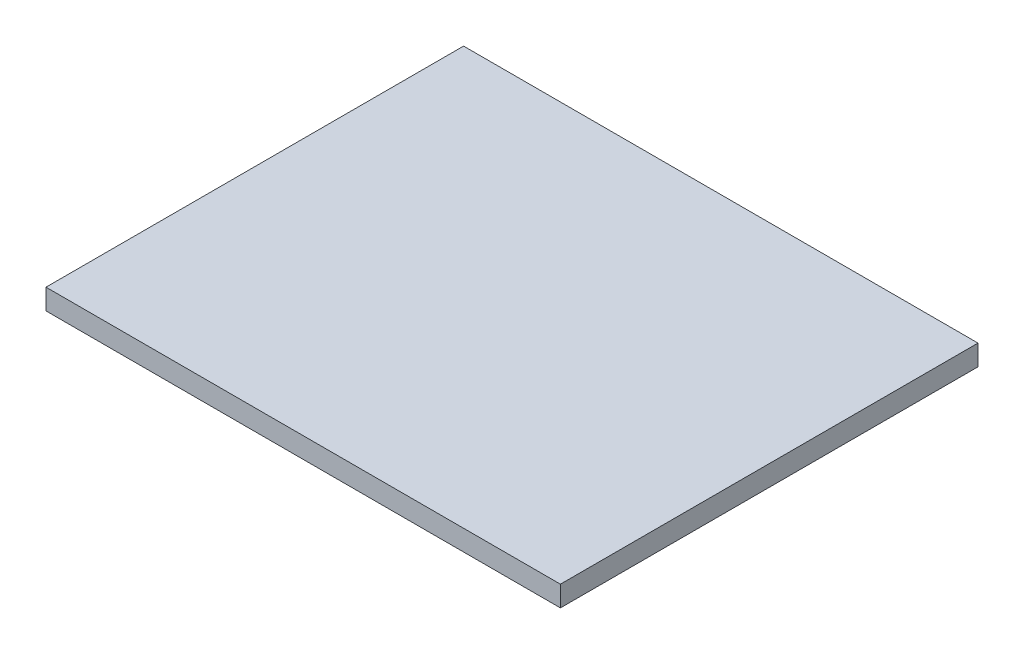
from build123d import *

# Parameters (mm, degrees)
SKETCH1_W           = 425
SKETCH1_H           = 345
BOSS_EXTRUDE1_DEPTH = 17


with BuildPart() as part:
    # Sketch1 → Boss-Extrude1 (new body)
    with BuildSketch(Plane(origin=(0, 0, 0), x_dir=(1, 0, 0), z_dir=(0, 1, 0))):
        Rectangle(SKETCH1_W, SKETCH1_H)
    extrude(amount=BOSS_EXTRUDE1_DEPTH)


solid = part.part
